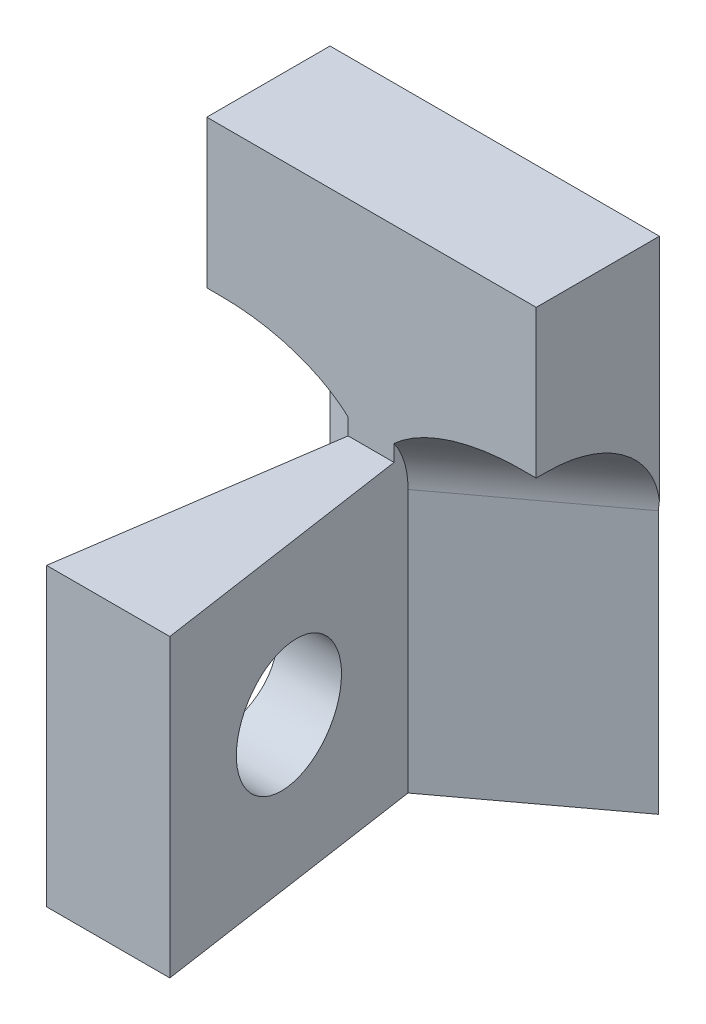
from build123d import *

# Parameters (mm, degrees)
BOSS_EXTRUDE1_DEPTH = 36
SKETCH2_R           = 7.5
CUT_EXTRUDE1_DEPTH  = 72.449282712
BOSS_EXTRUDE5_DEPTH = 7
SKETCH9_W           = 40.098560475
SKETCH9_H           = 15
BOSS_EXTRUDE6_DEPTH = 18
FILLET4_R           = 11


with BuildPart() as part:
    # Sketch1 → Boss-Extrude1 (new body)
    with BuildSketch(Plane(origin=(0, 0, 0), x_dir=(1, 0, 0), z_dir=(0, 1, 0))):
        Polygon((27.5, 0), (12.5, 0), (17.5, 34), (0, 47), (40, 47), (22.5, 34), align=None)
    extrude(amount=BOSS_EXTRUDE1_DEPTH)

    # Sketch2 → Cut-Extrude1 (cut, through all)
    with BuildSketch(Plane(origin=(0, 0, 0), x_dir=(0, 0, -1), z_dir=(1, 0, 0))):
        with Locations(Location((17, 18, 0), (0, 0, 180))):
            Circle(SKETCH2_R)
    extrude(amount=CUT_EXTRUDE1_DEPTH, mode=Mode.SUBTRACT)

    # Sketch7 → Boss-Extrude5 (add)
    with BuildSketch(Plane(origin=(0, 36, 0), x_dir=(1, 0, 0), z_dir=(0, 1, 0))):
        Polygon((0, 47), (40, 47), (22.5, 34), (22.794117647, 32), (17.205882353, 32), (17.5, 34), align=None)
    extrude(amount=BOSS_EXTRUDE5_DEPTH)

    # Sketch9 → Boss-Extrude6 (add)
    with BuildSketch(Plane(origin=(0, 43, 0), x_dir=(1, 0, 0), z_dir=(0, 1, 0))):
        with Locations((20.049280237, 39.5)):
            Rectangle(SKETCH9_W, SKETCH9_H)
    extrude(amount=BOSS_EXTRUDE6_DEPTH)

    # Fillet4
    fillet4_edges = [part.edges().sort_by_distance(p)[0] for p in [
        (31.25, 43, -40.5),
        (8.75, 43, -40.5),
    ]]
    fillet(fillet4_edges, radius=FILLET4_R)


solid = part.part
